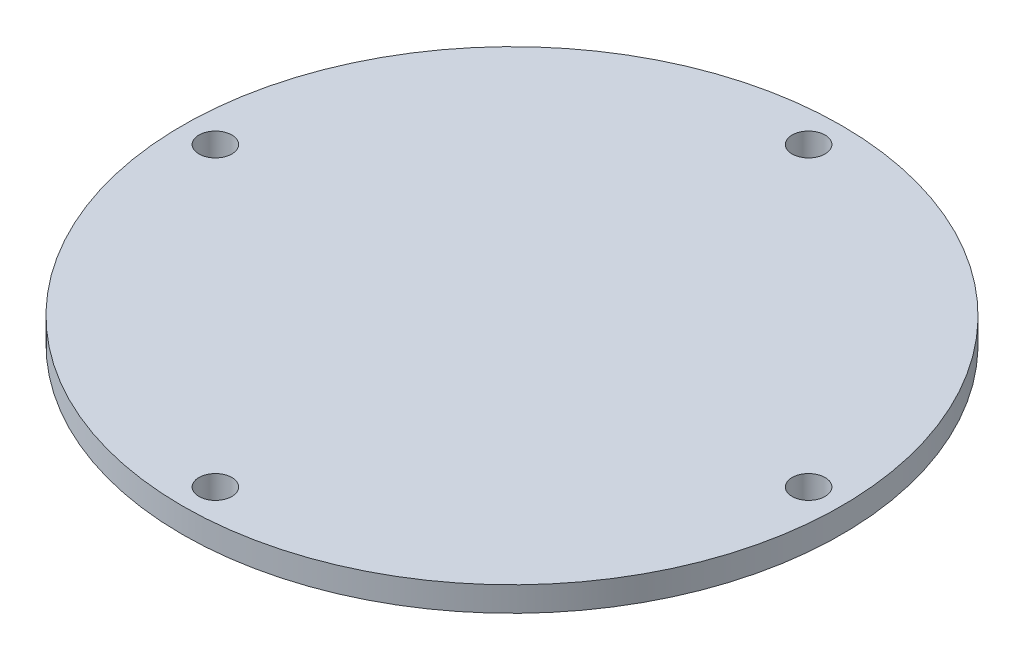
from build123d import *

# Parameters (mm, degrees)
SKETCH2_R           = 40
SKETCH2_R_2         = 2
BOSS_EXTRUDE1_DEPTH = 3


with BuildPart() as part:
    # Sketch2 → Boss-Extrude1 (new body)
    with BuildSketch(Plane(origin=(0, 0, 0), x_dir=(1, 0, 0), z_dir=(0, 1, 0))):
        with Locations(Location((0, 0, 0), (0, 0, 270))):
            Circle(SKETCH2_R)
        with Locations(Location((0, 36, 0), (0, 0, 270))):
            Circle(SKETCH2_R_2, mode=Mode.SUBTRACT)
        with Locations(Location((36, 0, 0), (0, 0, 270))):
            Circle(SKETCH2_R_2, mode=Mode.SUBTRACT)
        with Locations(Location((0, -36, 0), (0, 0, 270))):
            Circle(SKETCH2_R_2, mode=Mode.SUBTRACT)
        with Locations(Location((-36, 0, 0), (0, 0, 270))):
            Circle(SKETCH2_R_2, mode=Mode.SUBTRACT)
    extrude(amount=BOSS_EXTRUDE1_DEPTH)


solid = part.part
